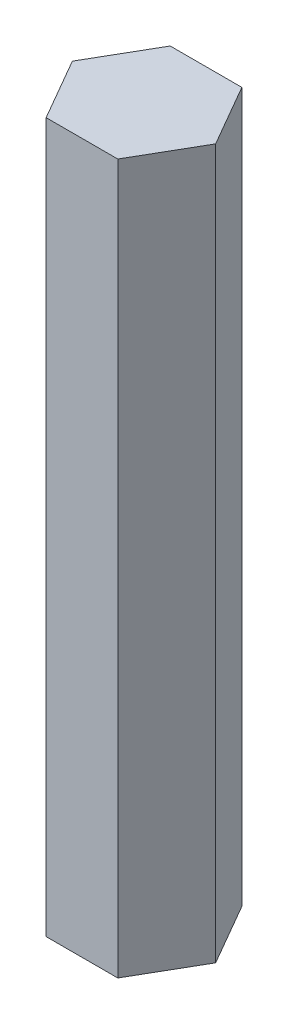
from build123d import *

# Parameters (mm, degrees)
BOSS_EXTRU_1_DEPTH = 29.7


with BuildPart() as part:
    # Esquisse3 → Boss.-Extru.1 (new body)
    with BuildSketch(Plane(origin=(0, 0, 0), x_dir=(1, 0, 0), z_dir=(0, 1, 0))):
        Polygon((3, 0), (1.5, 2.598076211), (-1.5, 2.598076211), (-3, 0), (-1.5, -2.598076211), (1.5, -2.598076211), align=None)
    extrude(amount=BOSS_EXTRU_1_DEPTH)


solid = part.part
